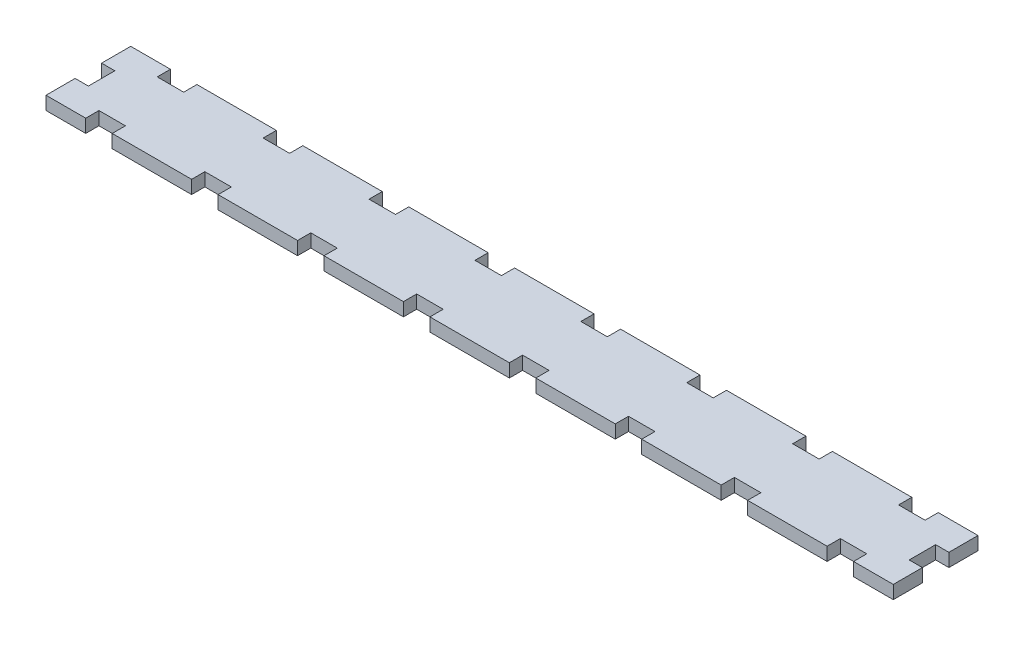
from build123d import *

# Parameters (mm, degrees)
SKETCH1_W               = 203.2
SKETCH1_H               = 20.32
BOSS_EXTRUDE1_DEPTH     = 3.175
SKETCH2_W               = 6.35
SKETCH2_H               = 3.175
CUT_EXTRUDE1_DEPTH      = 103.156087557
LPATTERN1_COUNT         = 8
LPATTERN1_PITCH         = 25.4
MIRROR1_COPY_1_SKETCH_W = 6.35
MIRROR1_COPY_1_SKETCH_H = 3.175
MIRROR1_COPY_1_DEPTH    = 103.156087557
MIRROR1_COPY_2_SKETCH_W = 6.35
MIRROR1_COPY_2_SKETCH_H = 3.175
MIRROR1_COPY_2_DEPTH    = 103.156087557
MIRROR1_COPY_3_SKETCH_W = 6.35
MIRROR1_COPY_3_SKETCH_H = 3.175
MIRROR1_COPY_3_DEPTH    = 103.156087557
MIRROR1_COPY_4_SKETCH_W = 6.35
MIRROR1_COPY_4_SKETCH_H = 3.175
MIRROR1_COPY_4_DEPTH    = 103.156087557
MIRROR1_COPY_5_SKETCH_W = 6.35
MIRROR1_COPY_5_SKETCH_H = 3.175
MIRROR1_COPY_5_DEPTH    = 103.156087557
MIRROR1_COPY_6_SKETCH_W = 6.35
MIRROR1_COPY_6_SKETCH_H = 3.175
MIRROR1_COPY_6_DEPTH    = 103.156087557
MIRROR1_COPY_7_SKETCH_W = 6.35
MIRROR1_COPY_7_SKETCH_H = 3.175
MIRROR1_COPY_7_DEPTH    = 103.156087557
SKETCH3_W               = 6.35
SKETCH3_H               = 6.35
CUT_EXTRUDE2_DEPTH      = 103.156087557


with BuildPart() as part:
    # Sketch1 → Boss-Extrude1 (new body)
    with BuildSketch(Plane(origin=(0, 0, 0), x_dir=(1, 0, 0), z_dir=(0, 1, 0))):
        Rectangle(SKETCH1_W, SKETCH1_H)
    extrude(amount=BOSS_EXTRUDE1_DEPTH)

    # Sketch2 → Cut-Extrude1 (cut, through all)
    with BuildSketch(Plane(origin=(0, 3.175, 0), x_dir=(1, 0, 0), z_dir=(0, 1, 0))):
        with Locations((88.9, 8.5725)):
            Rectangle(SKETCH2_W, SKETCH2_H)
    cut_extrude1 = extrude(amount=-CUT_EXTRUDE1_DEPTH, mode=Mode.SUBTRACT)

    # LPattern1: Cut-Extrude1 ×8
    with Locations(*[(-i * LPATTERN1_PITCH, 0, 0) for i in range(1, LPATTERN1_COUNT)]):
        add(cut_extrude1, mode=Mode.SUBTRACT)

    # Mirror1: Cut-Extrude1 across plane
    add(cut_extrude1.mirror(Plane.XY), mode=Mode.SUBTRACT)

    # Mirror1 copy 1 sketch → Mirror1 copy 1 (cut, through all)
    with BuildSketch(Plane(origin=(-25.4, 3.175, 0), x_dir=(1, 0, 0), z_dir=(0, 1, 0))):
        with Locations((88.9, -8.5725)):
            Rectangle(MIRROR1_COPY_1_SKETCH_W, MIRROR1_COPY_1_SKETCH_H)
    extrude(amount=-MIRROR1_COPY_1_DEPTH, mode=Mode.SUBTRACT)

    # Mirror1 copy 2 sketch → Mirror1 copy 2 (cut, through all)
    with BuildSketch(Plane(origin=(-50.8, 3.175, 0), x_dir=(1, 0, 0), z_dir=(0, 1, 0))):
        with Locations((88.9, -8.5725)):
            Rectangle(MIRROR1_COPY_2_SKETCH_W, MIRROR1_COPY_2_SKETCH_H)
    extrude(amount=-MIRROR1_COPY_2_DEPTH, mode=Mode.SUBTRACT)

    # Mirror1 copy 3 sketch → Mirror1 copy 3 (cut, through all)
    with BuildSketch(Plane(origin=(-76.2, 3.175, 0), x_dir=(1, 0, 0), z_dir=(0, 1, 0))):
        with Locations((88.9, -8.5725)):
            Rectangle(MIRROR1_COPY_3_SKETCH_W, MIRROR1_COPY_3_SKETCH_H)
    extrude(amount=-MIRROR1_COPY_3_DEPTH, mode=Mode.SUBTRACT)

    # Mirror1 copy 4 sketch → Mirror1 copy 4 (cut, through all)
    with BuildSketch(Plane(origin=(-101.6, 3.175, 0), x_dir=(1, 0, 0), z_dir=(0, 1, 0))):
        with Locations((88.9, -8.5725)):
            Rectangle(MIRROR1_COPY_4_SKETCH_W, MIRROR1_COPY_4_SKETCH_H)
    extrude(amount=-MIRROR1_COPY_4_DEPTH, mode=Mode.SUBTRACT)

    # Mirror1 copy 5 sketch → Mirror1 copy 5 (cut, through all)
    with BuildSketch(Plane(origin=(-127, 3.175, 0), x_dir=(1, 0, 0), z_dir=(0, 1, 0))):
        with Locations((88.9, -8.5725)):
            Rectangle(MIRROR1_COPY_5_SKETCH_W, MIRROR1_COPY_5_SKETCH_H)
    extrude(amount=-MIRROR1_COPY_5_DEPTH, mode=Mode.SUBTRACT)

    # Mirror1 copy 6 sketch → Mirror1 copy 6 (cut, through all)
    with BuildSketch(Plane(origin=(-152.4, 3.175, 0), x_dir=(1, 0, 0), z_dir=(0, 1, 0))):
        with Locations((88.9, -8.5725)):
            Rectangle(MIRROR1_COPY_6_SKETCH_W, MIRROR1_COPY_6_SKETCH_H)
    extrude(amount=-MIRROR1_COPY_6_DEPTH, mode=Mode.SUBTRACT)

    # Mirror1 copy 7 sketch → Mirror1 copy 7 (cut, through all)
    with BuildSketch(Plane(origin=(-177.8, 3.175, 0), x_dir=(1, 0, 0), z_dir=(0, 1, 0))):
        with Locations((88.9, -8.5725)):
            Rectangle(MIRROR1_COPY_7_SKETCH_W, MIRROR1_COPY_7_SKETCH_H)
    extrude(amount=-MIRROR1_COPY_7_DEPTH, mode=Mode.SUBTRACT)

    # Sketch3 → Cut-Extrude2 (cut, through all)
    with BuildSketch(Plane(origin=(0, 3.175, 0), x_dir=(1, 0, 0), z_dir=(0, 1, 0))):
        with Locations((101.6, 0)):
            Rectangle(SKETCH3_W, SKETCH3_H)
        with Locations((-101.6, 0)):
            Rectangle(SKETCH3_W, SKETCH3_H)
    extrude(amount=-CUT_EXTRUDE2_DEPTH, mode=Mode.SUBTRACT)


solid = part.part
